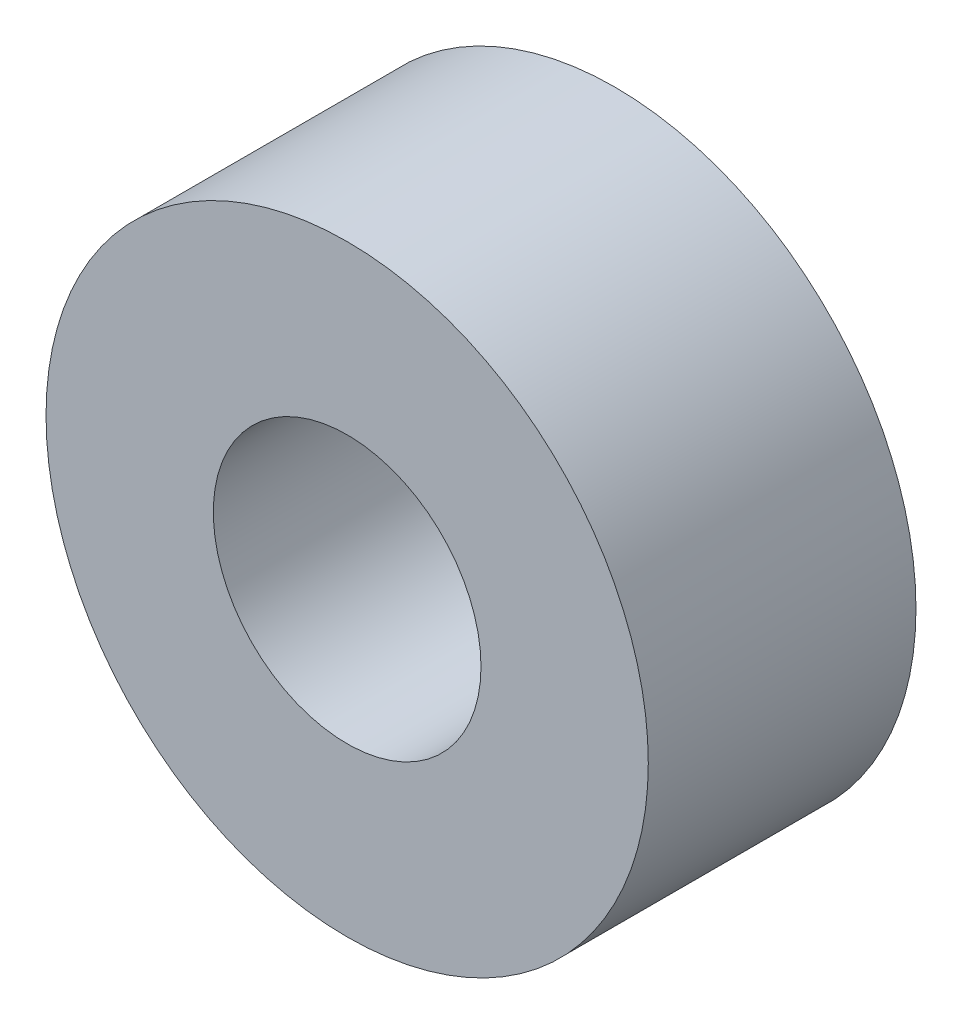
from build123d import *

# Parameters (mm, degrees)
SKETCH_1_R      = 4.5
SKETCH_1_R_2    = 2
EXTRUDE_1_DEPTH = 2


with BuildPart() as part:
    # 草图1 → 凸台-拉伸1 (new, symmetric)
    with BuildSketch(Plane.XY):
        Circle(SKETCH_1_R)
        Circle(SKETCH_1_R_2, mode=Mode.SUBTRACT)
    extrude(amount=EXTRUDE_1_DEPTH, both=True)


solid = part.part
